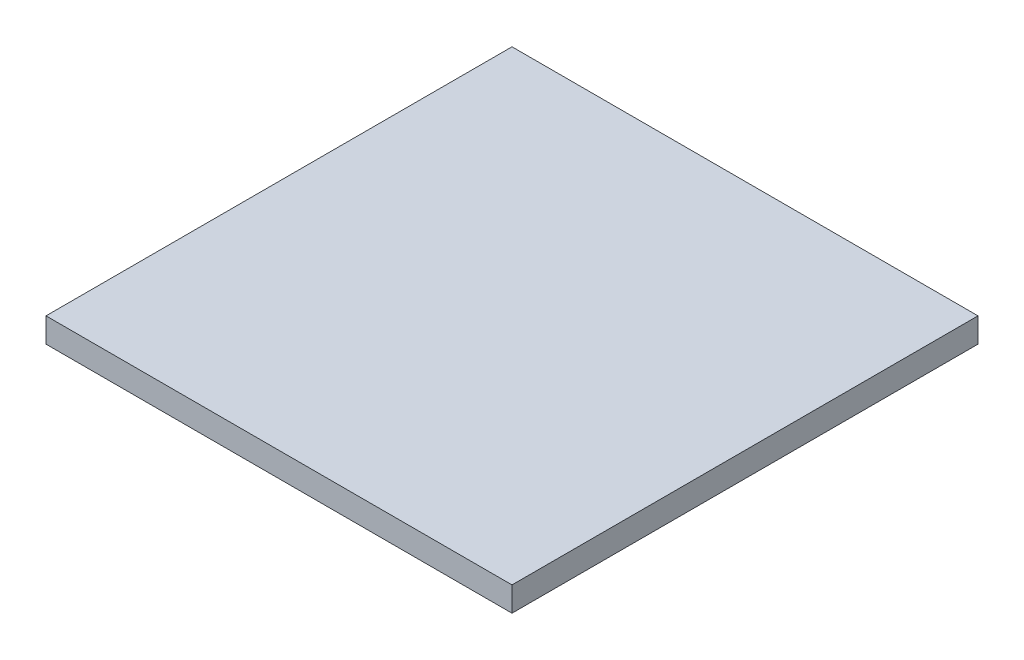
from build123d import *

# Parameters (mm, degrees)
CROQUIS2_W              = 95
CROQUIS2_H              = 95
SALIENTE_EXTRUIR1_DEPTH = 5


with BuildPart() as part:
    # Croquis2 → Saliente-Extruir1 (new body)
    with BuildSketch(Plane(origin=(0, 0, 0), x_dir=(1, 0, 0), z_dir=(0, 1, 0))):
        with Locations((47.5, 47.5)):
            Rectangle(CROQUIS2_W, CROQUIS2_H)
    extrude(amount=SALIENTE_EXTRUIR1_DEPTH)


solid = part.part
